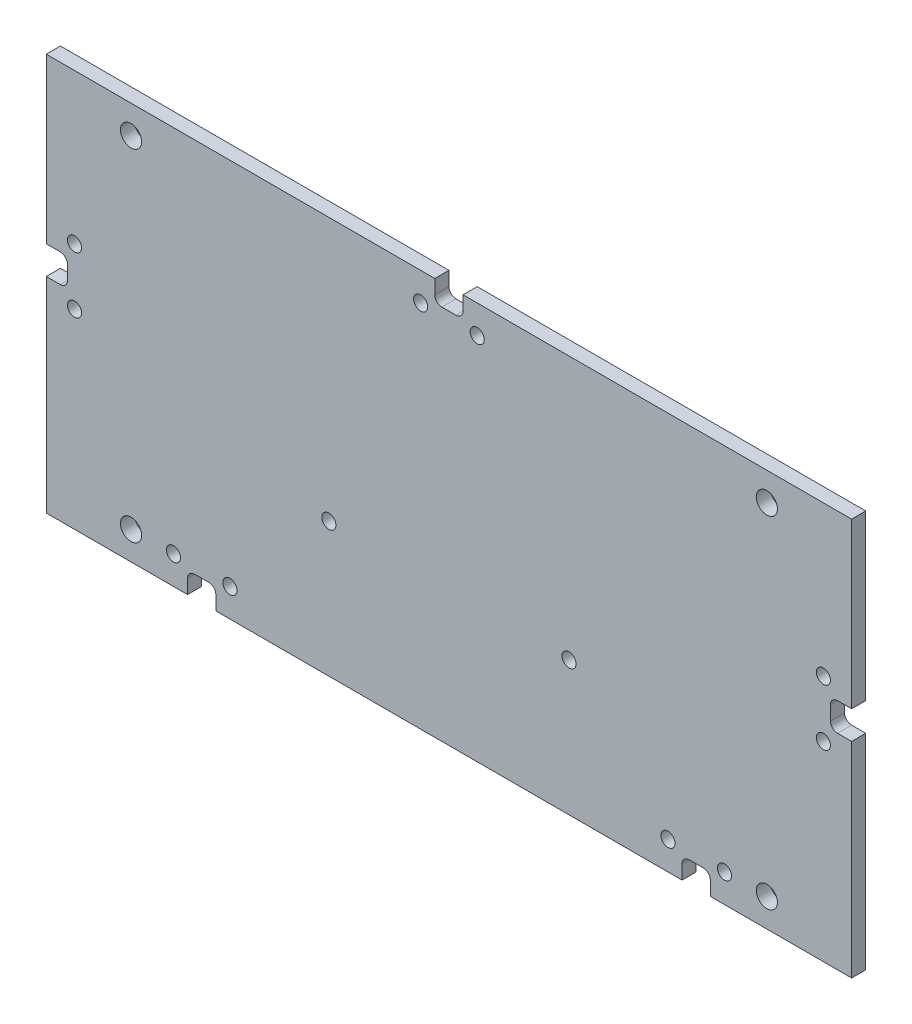
from build123d import *

# Parameters (mm, degrees)
SKETCH_1_R          = 1
EXTRUDE_1_DEPTH     = 2
SKETCH_2_R          = 1
CUT_EXTRUDE_1_DEPTH = 10
SKETCH_3_R          = 1.5
CUT_EXTRUDE_2_DEPTH = 10


with BuildPart() as part:
    # 草圖1 → 填料-伸長1 (new body)
    with BuildSketch(Plane.XY):
        with BuildLine():
            Line((23.861531606, 13.243524775), (25.861531606, 13.243524775))
            ThreePointArc((25.861531606, 13.243524775), (26.568638387, 13.536417994), (26.861531606, 14.243524775))
            Line((26.861531606, 14.243524775), (26.861531606, 16.243524775))
            Line((26.861531606, 16.243524775), (80.861531606, 16.243524775))
            Line((80.861531606, 16.243524775), (81.861531606, 16.243524775))
            Line((81.861531606, 16.243524775), (81.861531606, 15.243524775))
            Line((81.861531606, 15.243524775), (81.861531606, -7.006475225))
            Line((81.861531606, -7.006475225), (79.861531606, -7.006475225))
            ThreePointArc((79.861531606, -7.006475225), (79.154424825, -7.299368444), (78.861531606, -8.006475225))
            Line((78.861531606, -8.006475225), (78.861531606, -10.006475225))
            ThreePointArc((78.861531606, -10.006475225), (79.154424825, -10.713582006), (79.861531606, -11.006475225))
            Line((79.861531606, -11.006475225), (81.861531606, -11.006475225))
            Line((81.861531606, -11.006475225), (81.861531606, -39.006475225))
            Line((81.861531606, -39.006475225), (81.861531606, -40.006475225))
            Line((81.861531606, -40.006475225), (80.861531606, -40.006475225))
            Line((80.861531606, -40.006475225), (61.861531606, -40.006475225))
            Line((61.861531606, -40.006475225), (61.861531606, -38.006475225))
            ThreePointArc((61.861531606, -38.006475225), (61.568638387, -37.299368444), (60.861531606, -37.006475225))
            Line((60.861531606, -37.006475225), (58.861531606, -37.006475225))
            ThreePointArc((58.861531606, -37.006475225), (58.154424825, -37.299368444), (57.861531606, -38.006475225))
            Line((57.861531606, -38.006475225), (57.861531606, -40.006475225))
            Line((57.861531606, -40.006475225), (-8.138468394, -40.006475225))
            Line((-8.138468394, -40.006475225), (-8.138468394, -38.006475225))
            ThreePointArc((-8.138468394, -38.006475225), (-8.431361613, -37.299368444), (-9.138468394, -37.006475225))
            Line((-9.138468394, -37.006475225), (-11.138468394, -37.006475225))
            ThreePointArc((-11.138468394, -37.006475225), (-11.845575175, -37.299368444), (-12.138468394, -38.006475225))
            Line((-12.138468394, -38.006475225), (-12.138468394, -40.006475225))
            Line((-12.138468394, -40.006475225), (-31.138468394, -40.006475225))
            Line((-31.138468394, -40.006475225), (-32.138468394, -40.006475225))
            Line((-32.138468394, -40.006475225), (-32.138468394, -39.006475225))
            Line((-32.138468394, -39.006475225), (-32.138468394, -11.006475225))
            Line((-32.138468394, -11.006475225), (-30.138468394, -11.006475225))
            ThreePointArc((-30.138468394, -11.006475225), (-29.431361613, -10.713582006), (-29.138468394, -10.006475225))
            Line((-29.138468394, -10.006475225), (-29.138468394, -8.006475225))
            ThreePointArc((-29.138468394, -8.006475225), (-29.431361613, -7.299368444), (-30.138468394, -7.006475225))
            Line((-30.138468394, -7.006475225), (-32.138468394, -7.006475225))
            Line((-32.138468394, -7.006475225), (-32.138468394, 15.243524775))
            Line((-32.138468394, 15.243524775), (-32.138468394, 16.243524775))
            Line((-32.138468394, 16.243524775), (-31.138468394, 16.243524775))
            Line((-31.138468394, 16.243524775), (22.861531606, 16.243524775))
            Line((22.861531606, 16.243524775), (22.861531606, 14.243524775))
            ThreePointArc((22.861531606, 14.243524775), (23.154424825, 13.536417994), (23.861531606, 13.243524775))
        make_face()
        with Locations((55.861531606, -36.006475225)):
            Circle(SKETCH_1_R, mode=Mode.SUBTRACT)
        with Locations((77.861531606, -5.006475225)):
            Circle(SKETCH_1_R, mode=Mode.SUBTRACT)
        with Locations((-6.138468394, -36.006475225)):
            Circle(SKETCH_1_R, mode=Mode.SUBTRACT)
        with Locations((28.861531606, 12.243524775)):
            Circle(SKETCH_1_R, mode=Mode.SUBTRACT)
        with Locations((20.861531606, 12.243524775)):
            Circle(SKETCH_1_R, mode=Mode.SUBTRACT)
        with Locations((-28.138468394, -5.006475225)):
            Circle(SKETCH_1_R, mode=Mode.SUBTRACT)
        with Locations((-28.138468394, -13.006475225)):
            Circle(SKETCH_1_R, mode=Mode.SUBTRACT)
        with Locations((77.861531606, -13.006475225)):
            Circle(SKETCH_1_R, mode=Mode.SUBTRACT)
        with Locations((-14.138468394, -36.006475225)):
            Circle(SKETCH_1_R, mode=Mode.SUBTRACT)
        with Locations((63.861531606, -36.006475225)):
            Circle(SKETCH_1_R, mode=Mode.SUBTRACT)
    extrude(amount=EXTRUDE_1_DEPTH)

    # 草圖2 → 除料-伸長1 (cut)
    with BuildSketch(Plane.XY.offset(2)):
        with Locations((7.861531606, -21.006475225)):
            Circle(SKETCH_2_R)
        with Locations((41.861531606, -21.006475225)):
            Circle(SKETCH_2_R)
    extrude(amount=-CUT_EXTRUDE_1_DEPTH, mode=Mode.SUBTRACT)

    # 草圖3 → 除料-伸長2 (cut)
    with BuildSketch(Plane.XY.offset(2)):
        with Locations((-20.138468394, -36.006475225)):
            Circle(SKETCH_3_R)
        with Locations((-20.138468394, 12.243524775)):
            Circle(SKETCH_3_R)
        with Locations(Location((69.861531606, 12.243524775, 0), (0, 0, 180))):
            Circle(SKETCH_3_R)
        with Locations(Location((69.861531606, -36.006475225, 0), (0, 0, 180))):
            Circle(SKETCH_3_R)
    extrude(amount=-CUT_EXTRUDE_2_DEPTH, mode=Mode.SUBTRACT)


solid = part.part
